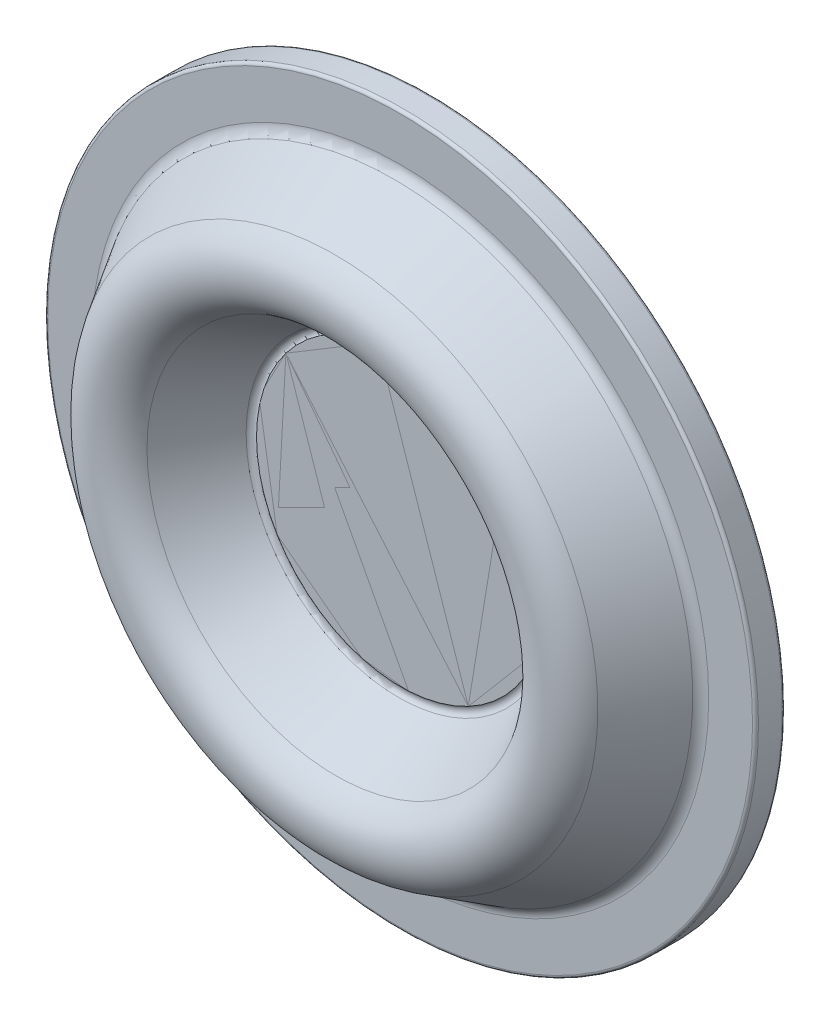
from build123d import *

# Parameters (mm, degrees)
EXTRUDE1_DEPTH = 0.1


with BuildPart() as part:
    # Sketch1 → Revolve1 (revolve)
    with BuildSketch(Plane(origin=(0, 0, 0), x_dir=(0, 0, -1), z_dir=(1, 0, 0)), mode=Mode.PRIVATE) as revolve1_sk:
        with BuildLine():
            Line((0, 57.75), (0, 59.25))
            ThreePointArc((0, 59.25), (-0.146446609, 59.603553391), (-0.5, 59.75))
            Line((-0.5, 59.75), (-4.5, 59.75))
            ThreePointArc((-4.5, 59.75), (-4.853553391, 59.603553391), (-5, 59.25))
            Line((-5, 59.25), (-5, 51.879411765))
            ThreePointArc((-5, 51.879411765), (-5.258492866, 50.895972442), (-5.967152902, 50.166745168))
            Line((-5.967152902, 50.166745168), (-15.918249554, 44.165599748))
            ThreePointArc((-15.918249554, 44.165599748), (-19.39967269, 37.93134753), (-15.8, 31.764617093))
            Line((-15.8, 31.764617093), (-5.235650443, 25.665287032))
            ThreePointArc((-5.235650443, 25.665287032), (-4.762639717, 25.03002152), (-4.9, 24.25))
            Line((-4.9, 24.25), (-4.9, 0))
            Line((-4.9, 0), (0.1, 0))
            Line((0.1, 0), (0.1, 21.5))
            ThreePointArc((0.1, 21.5), (-0.580435314, 24.039419162), (-2.439419162, 25.898403011))
            Line((-2.439419162, 25.898403011), (-15, 33.150257739))
            ThreePointArc((-15, 33.150257739), (-17.799745425, 37.946603635), (-15.091971875, 42.795466471))
            Line((-15.091971875, 42.795466471), (-5.417882254, 48.629558998))
            ThreePointArc((-5.417882254, 48.629558998), (-3.646232165, 50.452627183), (-3, 52.91122549))
            Line((-3, 52.91122549), (-3, 54.75))
            ThreePointArc((-3, 54.75), (-2.926776695, 54.926776695), (-2.75, 55))
            Line((-2.75, 55), (-0.8, 55))
            ThreePointArc((-0.8, 55), (-0.234314575, 55.234314575), (0, 55.8))
            Line((0, 55.8), (0, 56.266760303))
            ThreePointArc((0, 56.266760303), (0.5, 57.008380151), (0, 57.75))
        make_face()
    revolve(revolve1_sk.sketch.rotate(Axis((0, 0, -0.1), (0, 0, 1)), 90), axis=Axis((0, 0, -0.1), (0, 0, 1)))

    # Sketch2 → Extrude1 (add)
    # profile 1 of 10: a face of its own
    with BuildSketch(Plane(origin=(0, 0, -0.1), x_dir=(-1, 0, 0), z_dir=(0, 0, -1))):
        Polygon((8.427493068, 0.579014882), (8.42048185, 0.288550138), (7.435405728, -0.282864124), (8.391435376, -0.906862522), (8.384424158, -1.193821656), (7.197024318, -0.424090086), (5.896443388, -1.182303227), (5.903454606, -0.891838483), (6.962148517, -0.271345695), (5.935005087, 0.403233632), (5.942016305, 0.693698376), (7.204035536, -0.130119733), align=None)
    # profile 2 of 10: a face of its own
    with BuildSketch(Plane(origin=(0, 0, -0.1), x_dir=(-1, 0, 0), z_dir=(0, 0, -1))):
        Polygon((7.58096663, 3.689873672), (7.680626085, 3.417938576), (6.976499482, 2.5290163), (8.089279931, 2.300650915), (8.187937783, 2.031720627), (6.807228649, 2.311668544), (5.879243873, 1.134785531), (5.779584418, 1.406720627), (6.533791149, 2.367257486), (5.336876085, 2.617157326), (5.23721663, 2.889092422), (6.706567591, 2.586608447), align=None)
    # profile 3 of 10: a face of its own
    with BuildSketch(Plane(origin=(0, 0, -0.1), x_dir=(-1, 0, 0), z_dir=(0, 0, -1))):
        with BuildLine():
            add(Edge.make_bspline(
                [(4.829462598, 5.354665301), (4.859515722, 5.380566255), (4.917909756, 5.43089251), (5.005632287, 5.501007194), (5.090233733, 5.564259547), (5.171837523, 5.620550367), (5.250438829, 5.669556849), (5.325587202, 5.712316581), (5.398338432, 5.746588033), (5.467921443, 5.775282882), (5.535573938, 5.797113068), (5.601317185, 5.815096187), (5.666141311, 5.827456032), (5.729683737, 5.835761609), (5.791974957, 5.838608411), (5.852938018, 5.837365781), (5.912533875, 5.830688952), (5.970837303, 5.81976856), (6.027131532, 5.804092394), (6.081506667, 5.78522989), (6.13337698, 5.761980693), (6.183079787, 5.734822792), (6.230709745, 5.703984228), (6.275476632, 5.668439719), (6.318159226, 5.629430731), (6.344580952, 5.600918106), (6.357908111, 5.586536294)],
                knots=[0, 0, 0, 0, 1.642488733, 3.191400083, 4.648330986, 6.015200803, 7.294334373, 8.482534018, 9.592369432, 10.621682201, 11.596460416, 12.533612807, 13.441772991, 14.326460331, 15.18447772, 16.021015197, 16.848365984, 17.664380673, 18.474225585, 19.265513997, 20.045156461, 20.824553811, 21.608595201, 22.39117303, 23.188505227, 24, 24, 24, 24], degree=3))
            add(Edge.make_bspline(
                [(6.357908111, 5.586536294), (6.370663635, 5.57136439), (6.395999655, 5.541228768), (6.429604734, 5.493035796), (6.45854655, 5.44277215), (6.483826665, 5.391190882), (6.504451542, 5.337534896), (6.521008999, 5.282140387), (6.532875019, 5.224803807), (6.541000824, 5.166095409), (6.544619423, 5.105969592), (6.542795236, 5.044714229), (6.537193412, 4.982501401), (6.524987108, 4.91957316), (6.509465033, 4.855429528), (6.487216782, 4.790669714), (6.461472366, 4.724612726), (6.430231819, 4.657592195), (6.392844613, 4.589737124), (6.349304229, 4.520476396), (6.298258599, 4.45048981), (6.241260791, 4.37869889), (6.176754032, 4.306128858), (6.105699729, 4.232009695), (6.027393055, 4.156972662), (5.972107089, 4.107505726), (5.943745451, 4.082129243)],
                knots=[0, 0, 0, 0, 0.814887852, 1.618593979, 2.412238445, 3.198274633, 3.978533278, 4.773542466, 5.573339307, 6.384052086, 7.209285215, 8.047101608, 8.902372354, 9.774937374, 10.680737127, 11.61426269, 12.588260703, 13.595679452, 14.652596965, 15.772562546, 16.957712156, 18.213231358, 19.541071545, 20.949172172, 22.434928736, 24, 24, 24, 24], degree=3))
            add(Edge.make_bspline(
                [(5.943745451, 4.082129243), (5.915077344, 4.057333071), (5.859251656, 4.009047241), (5.774175105, 3.942770711), (5.692421168, 3.88163712), (5.611871093, 3.828181258), (5.53409843, 3.780127256), (5.457674838, 3.739849782), (5.384197084, 3.704605491), (5.312118324, 3.677253455), (5.242235755, 3.654954072), (5.173783727, 3.637929646), (5.106929703, 3.625208771), (5.041311055, 3.617756329), (4.977219727, 3.614478892), (4.914444846, 3.616660825), (4.85311804, 3.62295809), (4.793500639, 3.634529288), (4.736065057, 3.650747686), (4.680431518, 3.670084635), (4.627559405, 3.694350006), (4.576667712, 3.721827789), (4.528417655, 3.753502398), (4.482923323, 3.789249078), (4.439223887, 3.828428518), (4.412720162, 3.857529832), (4.399274297, 3.872293506)],
                knots=[0, 0, 0, 0, 1.560070584, 3.037940933, 4.438489039, 5.761211452, 7.016374073, 8.19996777, 9.315894119, 10.36876234, 11.370678667, 12.334028098, 13.270759348, 14.170041052, 15.050617455, 15.91005184, 16.753176901, 17.58607403, 18.406373934, 19.208393501, 20.008024827, 20.798329821, 21.58740891, 22.380576906, 23.178434556, 24, 24, 24, 24], degree=3))
            add(Edge.make_bspline(
                [(4.399274297, 3.872293506), (4.386705453, 3.887313581), (4.361828571, 3.91704206), (4.328576576, 3.964278001), (4.300100031, 4.013539718), (4.275489907, 4.064250869), (4.254653032, 4.116527737), (4.238825783, 4.170761259), (4.226761027, 4.226652224), (4.218544519, 4.284039406), (4.215790282, 4.34285538), (4.217160768, 4.402635609), (4.223725812, 4.463272659), (4.235468725, 4.524463357), (4.251510558, 4.586422847), (4.272724421, 4.649123864), (4.298792202, 4.712692009), (4.330109331, 4.777320531), (4.367462847, 4.843284152), (4.411547646, 4.911034336), (4.463766041, 4.980033673), (4.522088756, 5.05179943), (4.588781293, 5.124856415), (4.662147679, 5.200307899), (4.742980682, 5.277484887), (4.800096413, 5.328457575), (4.829462598, 5.354665301)],
                knots=[0, 0, 0, 0, 0.811922845, 1.606998058, 2.391791105, 3.168883449, 3.942731651, 4.722471048, 5.508606248, 6.312343221, 7.123321215, 7.947341338, 8.789764739, 9.64916698, 10.528957928, 11.441788542, 12.391764569, 13.376295501, 14.417802825, 15.533330903, 16.725360975, 18.004365054, 19.366853102, 20.825644787, 22.3678979, 24, 24, 24, 24], degree=3))
        make_face()
        with BuildLine():
            add(Edge.make_bspline(
                [(4.980203784, 5.175879243), (4.954870722, 5.153482167), (4.90564869, 5.109964744), (4.836386041, 5.044618912), (4.773298466, 4.981775216), (4.716782558, 4.921207686), (4.666076675, 4.863294469), (4.621657902, 4.807682292), (4.584187222, 4.754227111), (4.552459966, 4.70293798), (4.526430437, 4.653049433), (4.504112177, 4.60409137), (4.485628628, 4.5557793), (4.470822702, 4.507811494), (4.460332902, 4.460239027), (4.453693859, 4.413015864), (4.451326589, 4.366276801), (4.452448768, 4.305813724), (4.46314901, 4.233360474), (4.486831172, 4.151914122), (4.523086115, 4.07743129), (4.556712895, 4.034846083), (4.573553143, 4.013519467)],
                knots=[0, 0, 0, 0, 1.473920474, 2.863821205, 4.150201783, 5.354957461, 6.474200233, 7.504975634, 8.455825835, 9.318219059, 10.131960271, 10.907040598, 11.662504215, 12.385299015, 13.093289977, 13.783825973, 14.461552013, 15.131181992, 16.417562571, 17.640097958, 18.81816414, 20, 20, 20, 20], degree=3))
            add(Edge.make_bspline(
                [(4.573553143, 4.013519467), (4.592430763, 3.993907072), (4.630106996, 3.954764363), (4.698728467, 3.909214273), (4.775032359, 3.874138104), (4.844484874, 3.854842473), (4.90320209, 3.845695364), (4.949090347, 3.841854164), (4.996168203, 3.843274093), (5.044347082, 3.847767039), (5.093595043, 3.855744295), (5.143769244, 3.867918298), (5.195134737, 3.88398494), (5.229182384, 3.89744645), (5.246630066, 3.904344788)],
                knots=[0, 0, 0, 0, 1.339307148, 2.673009043, 4.032488258, 5.46888385, 6.210705413, 6.962197101, 7.736351905, 8.530265239, 9.347863837, 10.194627868, 11.074838878, 12, 12, 12, 12], degree=3))
            add(Edge.make_bspline(
                [(5.246630066, 3.904344788), (5.268455261, 3.913421922), (5.313035702, 3.931963001), (5.378718342, 3.965444949), (5.445592444, 4.002337937), (5.512578139, 4.044333391), (5.5810096, 4.089631393), (5.649234343, 4.140520018), (5.718664601, 4.194955453), (5.763945033, 4.234019078), (5.78699465, 4.253904083)],
                knots=[0, 0, 0, 0, 0.877152727, 1.791684176, 2.734845229, 3.711608245, 4.725637924, 5.780374372, 6.870118559, 8, 8, 8, 8], degree=3))
            add(Edge.make_bspline(
                [(5.78699465, 4.253904083), (5.809884968, 4.274067325), (5.854571758, 4.313430279), (5.916854379, 4.374446956), (5.975335824, 4.433525254), (6.029094323, 4.491777786), (6.076844671, 4.550169607), (6.120944085, 4.606642255), (6.159441283, 4.662743319), (6.193142728, 4.717955711), (6.222207516, 4.772218042), (6.247454789, 4.825231706), (6.268146875, 4.877405192), (6.284056713, 4.928536721), (6.296350954, 4.978147436), (6.304048277, 5.026729566), (6.306973423, 5.074181306), (6.305604645, 5.134785333), (6.295773449, 5.207016657), (6.271680233, 5.287753292), (6.236282052, 5.361796488), (6.202837504, 5.403798921), (6.186133271, 5.42477748)],
                knots=[0, 0, 0, 0, 1.330306613, 2.597042568, 3.801871273, 4.956318127, 6.05267893, 7.09107421, 8.080714344, 9.01853261, 9.911137326, 10.764509986, 11.57848574, 12.356869381, 13.098597071, 13.806082635, 14.499183832, 15.169221176, 16.448161396, 17.664464501, 18.833492115, 20, 20, 20, 20], degree=3))
            add(Edge.make_bspline(
                [(6.186133271, 5.42477748), (6.167273184, 5.444418054), (6.12953591, 5.48371701), (6.060189257, 5.529090237), (5.983256767, 5.564801941), (5.91284581, 5.583886601), (5.853314772, 5.593220138), (5.806924483, 5.596601007), (5.759533351, 5.596745312), (5.711145444, 5.592557422), (5.661736394, 5.584630383), (5.611334933, 5.572228529), (5.559966033, 5.55682857), (5.507019509, 5.537517381), (5.45204781, 5.513305585), (5.39434389, 5.482895514), (5.333273535, 5.446651203), (5.268561126, 5.404683044), (5.201289906, 5.355642534), (5.129854126, 5.301797395), (5.056038692, 5.240883457), (5.006006911, 5.197997183), (4.980203784, 5.175879243)],
                knots=[0, 0, 0, 0, 1.183368572, 2.36781009, 3.585261283, 4.868432326, 5.531069654, 6.209571802, 6.893435229, 7.594269795, 8.323854549, 9.072027919, 9.854570908, 10.660110258, 11.526585574, 12.470253211, 13.500861359, 14.620784476, 15.830166201, 17.128081046, 18.518851668, 20, 20, 20, 20], degree=3))
        make_face(mode=Mode.SUBTRACT)
    # profile 4 of 10: a face of its own
    with BuildSketch(Plane(origin=(0, 0, -0.1), x_dir=(-1, 0, 0), z_dir=(0, 0, -1))):
        with BuildLine():
            Line((3.141851066, 6.975360046), (2.932015329, 7.089041937))
            add(Edge.make_bspline(
                [(2.932015329, 7.089041937), (2.947551586, 7.114908542), (2.978003097, 7.165607832), (3.031341775, 7.234986314), (3.088148445, 7.297648017), (3.149364564, 7.353328587), (3.214645885, 7.402164719), (3.28440109, 7.443933684), (3.358641268, 7.477933066), (3.435862714, 7.505383595), (3.515125101, 7.525598243), (3.594896274, 7.536806374), (3.674198593, 7.541246991), (3.752998065, 7.536752796), (3.83120428, 7.523198504), (3.909036844, 7.502945412), (3.986280778, 7.473552559), (4.03599389, 7.448407552), (4.06132222, 7.435596424)],
                knots=[0, 0, 0, 0, 1.099935885, 2.155905941, 3.186136701, 4.181956904, 5.169700633, 6.155584185, 7.141900213, 8.143457385, 9.141880947, 10.120212618, 11.077527577, 12.035171747, 12.992254254, 13.968612868, 14.965028724, 16, 16, 16, 16], degree=3))
            add(Edge.make_bspline(
                [(4.06132222, 7.435596424), (4.085636807, 7.421678872), (4.133207508, 7.394449634), (4.198507256, 7.346993114), (4.257021491, 7.295845404), (4.308570372, 7.240303619), (4.353319144, 7.180596707), (4.391074734, 7.11660445), (4.421955441, 7.048474447), (4.444899844, 6.976719197), (4.461828619, 6.903853392), (4.472294437, 6.831125196), (4.47448226, 6.759476729), (4.470689414, 6.688693708), (4.459550995, 6.618900609), (4.441505501, 6.549879007), (4.415821129, 6.482039495), (4.393913657, 6.438487094), (4.382836643, 6.416465815)],
                knots=[0, 0, 0, 0, 1.126523212, 2.204006057, 3.241474893, 4.249032068, 5.247097567, 6.237722838, 7.232710116, 8.250091699, 9.263474823, 10.23992759, 11.200966984, 12.142804039, 13.088011767, 14.039403608, 15.008669148, 16, 16, 16, 16], degree=3))
            add(Edge.make_bspline(
                [(4.382836643, 6.416465815), (4.365275025, 6.386375242), (4.330524537, 6.326832769), (4.264321741, 6.247137979), (4.189767146, 6.175503947), (4.118423889, 6.123784485), (4.054741292, 6.0854271), (3.999389358, 6.056074109), (3.937118556, 6.025459849), (3.867643818, 5.994052701), (3.79096205, 5.962063078), (3.707049868, 5.929573436), (3.616032165, 5.896086457), (3.552709117, 5.87400234), (3.519956034, 5.862579597)],
                knots=[0, 0, 0, 0, 1.190280692, 2.355297623, 3.530907103, 4.720145854, 5.360764823, 6.073711646, 6.863011546, 7.734665729, 8.681917222, 9.705461596, 10.813177678, 12, 12, 12, 12], degree=3))
            Line((3.519956034, 5.862579597), (2.658077027, 5.569610847))
            Line((2.658077027, 5.569610847), (3.667692412, 5.02373745))
            Line((3.667692412, 5.02373745), (3.55350972, 4.812399309))
            Line((3.55350972, 4.812399309), (2.068133117, 5.615684565))
            Line((2.068133117, 5.615684565), (3.391750906, 6.066405719))
            add(Edge.make_bspline(
                [(3.391750906, 6.066405719), (3.423825593, 6.077355409), (3.48558162, 6.098437745), (3.574106943, 6.129874189), (3.654745834, 6.159920762), (3.727539717, 6.188243922), (3.792083748, 6.215831986), (3.848784292, 6.241709879), (3.897549856, 6.26630151), (3.951948291, 6.296358684), (4.010989491, 6.337427803), (4.072000114, 6.394003412), (4.12617913, 6.456266879), (4.153679047, 6.503445405), (4.167492091, 6.527142898)],
                knots=[0, 0, 0, 0, 1.318769796, 2.539135651, 3.65517763, 4.667189653, 5.578094506, 6.386077576, 7.091972318, 7.702690895, 8.803679468, 9.879431236, 10.934850913, 12, 12, 12, 12], degree=3))
            add(Edge.make_bspline(
                [(4.167492091, 6.527142898), (4.175358187, 6.5425099), (4.190834934, 6.572744875), (4.207677746, 6.620270649), (4.219968427, 6.668352994), (4.227022871, 6.717211612), (4.228394818, 6.766914347), (4.224842447, 6.817060665), (4.216285803, 6.868083899), (4.202287762, 6.918994732), (4.183779129, 6.96888905), (4.161515459, 7.016620606), (4.134297643, 7.060851653), (4.102774596, 7.101663521), (4.06789117, 7.14007383), (4.027872477, 7.174488504), (3.984263699, 7.206375909), (3.952665847, 7.224547343), (3.9366227, 7.233773507)],
                knots=[0, 0, 0, 0, 1.00116397, 1.969816071, 2.919326737, 3.878627191, 4.828731053, 5.800142095, 6.792639446, 7.826973114, 8.860216765, 9.878861516, 10.879368707, 11.867836799, 12.869094559, 13.885524461, 14.926419358, 16, 16, 16, 16], degree=3))
            add(Edge.make_bspline(
                [(3.9366227, 7.233773507), (3.919244379, 7.242613632), (3.885138239, 7.259962979), (3.83211138, 7.28005229), (3.779109809, 7.294605783), (3.725786737, 7.303798928), (3.672385829, 7.307492163), (3.618727565, 7.304551846), (3.564949683, 7.29736268), (3.511468115, 7.283627856), (3.458763486, 7.264606189), (3.407551494, 7.240000334), (3.358261387, 7.209746398), (3.311027993, 7.173960841), (3.26564863, 7.132513367), (3.222397218, 7.08537585), (3.180323496, 7.032984704), (3.154917891, 6.994931759), (3.141851066, 6.975360046)],
                knots=[0, 0, 0, 0, 1.004886141, 1.972157565, 2.918203442, 3.835292396, 4.758381908, 5.671908394, 6.602035945, 7.552029479, 8.513306314, 9.487448734, 10.476651728, 11.490750971, 12.538881492, 13.641488584, 14.786950435, 16, 16, 16, 16], degree=3))
        make_face()
    # profile 5 of 10: a face of its own
    with BuildSketch(Plane(origin=(0, 0, -0.1), x_dir=(-1, 0, 0), z_dir=(0, 0, -1))):
        Polygon((2.120654045, 8.252248397), (0.612240583, 5.595998397), (0.358835134, 5.64006891), (1.865245391, 8.296819711), align=None)
    # profile 6 of 10: a face of its own
    with BuildSketch(Plane(origin=(0, 0, -0.1), x_dir=(-1, 0, 0), z_dir=(0, 0, -1))):
        Polygon((-2.223437278, 8.151519011), (-1.935476541, 8.198594331), (-1.188781829, 7.333710517), (-0.75158231, 8.392404427), (-0.467127182, 8.438978946), (-1.004987759, 7.125377184), (-0.015404425, 5.983550261), (-0.303365163, 5.93647494), (-1.112159233, 6.864960517), (-1.585917246, 5.726639203), (-1.873877983, 5.679563882), (-1.296454105, 7.077300261), align=None)
    # profile 7 of 10: a face of its own
    with BuildSketch(Plane(origin=(0, 0, -0.1), x_dir=(-1, 0, 0), z_dir=(0, 0, -1))):
        Polygon((-5.134658962, 6.694922242), (-4.886762327, 6.84666503), (-3.873641333, 6.33083971), (-3.868633321, 7.470663428), (-3.624242295, 7.620403011), (-3.625744699, 6.207141793), (-2.284598865, 5.528055255), (-2.5324955, 5.376312466), (-3.626746301, 5.927694678), (-3.635259923, 4.700731537), (-3.883156558, 4.548487947), (-3.87614534, 6.053896601), align=None)
    # profile 8 of 10: a face of its own
    with BuildSketch(Plane(origin=(0, 0, -0.1), x_dir=(-1, 0, 0), z_dir=(0, 0, -1))):
        Polygon((-6.174704096, 5.895577601), (-4.584159224, 3.260862057), (-4.748422044, 3.059539941), (-6.339968519, 5.692753082), align=None)
    # profile 9 of 10: a face of its own
    with BuildSketch(Plane(origin=(0, 0, -0.1), x_dir=(-1, 0, 0), z_dir=(0, 0, -1))):
        Polygon((-8.202257198, 2.031527168), (-8.103098545, 2.305966271), (-6.983306878, 2.53633486), (-7.694444698, 3.43477236), (-7.596287647, 3.706206655), (-6.710870981, 2.59492861), (-5.231503993, 2.902420597), (-5.330662647, 2.627981495), (-6.536592134, 2.374576046), (-5.773370981, 1.405024764), (-5.872529634, 1.130585662), (-6.811532038, 2.316983899), align=None)
    # profile 10 of 10: a face of its own
    with BuildSketch(Plane(origin=(0, 0, -0.1), x_dir=(-1, 0, 0), z_dir=(0, 0, -1))):
        Polygon((-8.351943904, -1.224961399), (-8.363462333, -0.934496656), (-7.41694791, -0.300482233), (-8.411539256, 0.260916004), (-8.423057686, 0.547875139), (-7.188081724, -0.143731431), (-5.938582526, 0.697113921), (-5.927064096, 0.406649178), (-6.943690699, -0.281451784), (-5.874980763, -0.888422938), (-5.862961532, -1.178887681), (-7.176062494, -0.437701784), align=None)
    extrude(amount=EXTRUDE1_DEPTH)


with BuildPart() as body_2:
    # Sketch3 → Revolve2 (revolve)
    with BuildSketch(Plane(origin=(0, 0, 0), x_dir=(0, 0, -1), z_dir=(1, 0, 0)), mode=Mode.PRIVATE) as revolve2_sk:
        with BuildLine():
            Line((-4.9, 24.25), (-4.31000318, 23.881251987))
            ThreePointArc((-4.31000318, 23.881251987), (-3.276072556, 22.791562673), (-2.9, 21.337257075))
            Line((-2.9, 21.337257075), (-2.9, 0))
            Line((-2.9, 0), (-4.9, 0))
            Line((-4.9, 0), (-4.9, 24.25))
        make_face()
    revolve(revolve2_sk.sketch.rotate(Axis((0, 0, 0), (0, 0, 1)), 90), axis=Axis((0, 0, 0), (0, 0, 1)))


solid = Compound([part.part, body_2.part])
